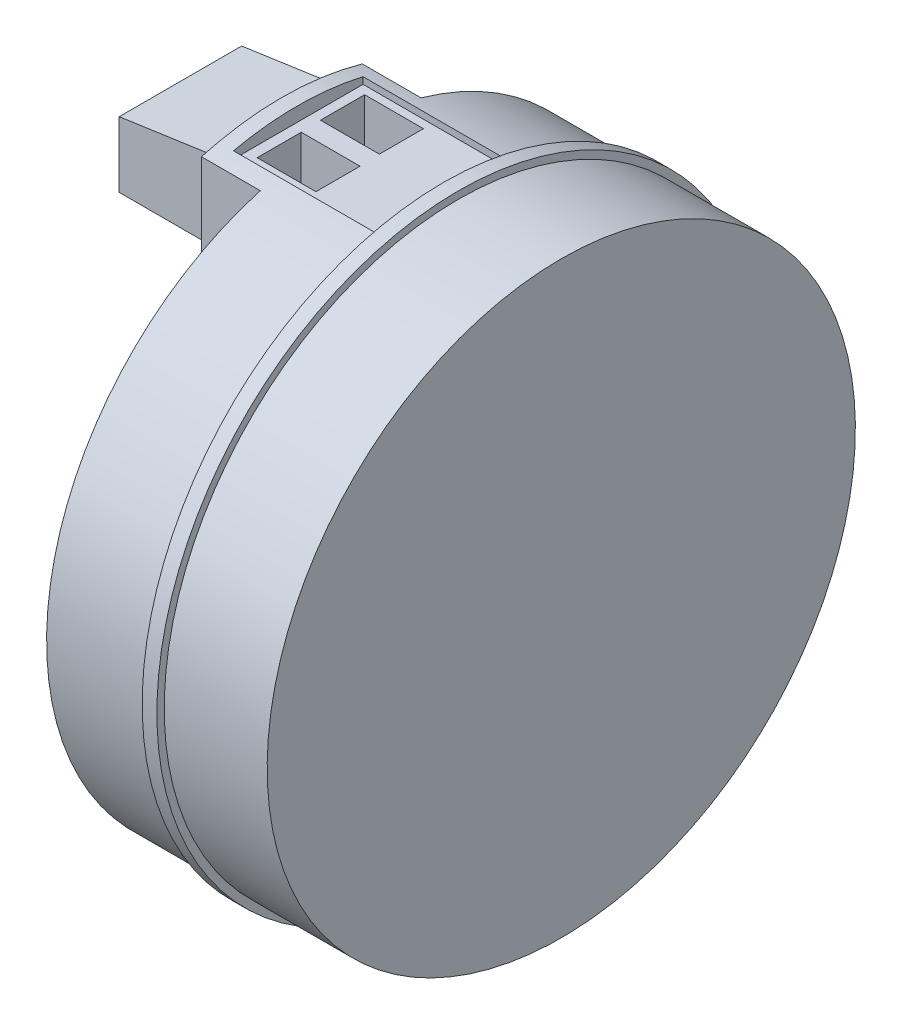
from build123d import *

# Parameters (mm, degrees)
SKETCH1_W           = 25.9
SKETCH1_H           = 20
CUT_EXTRUDE1_START  = -6.9
CUT_EXTRUDE1_DEPTH  = 6.9
CUT_EXTRUDE3_DEPTH  = 37.9
CUT_EXTRUDE4_START  = -4
CUT_EXTRUDE4_DEPTH  = 4
SKETCH5_W           = 3.079292118
SKETCH5_H           = 1.929571357
SKETCH5_H_2         = 4.46
SKETCH5_W_2         = 3.459055715
CUT_EXTRUDE5_DEPTH  = 6.9
CUT_EXTRUDE6_START  = -4
SKETCH6_W           = 1.774907729
SKETCH6_H           = 5.455649351
CUT_EXTRUDE6_DEPTH  = 4
SKETCH7_R           = 20.5
BOSS_EXTRUDE1_DEPTH = 0.5
SKETCH8_W           = 5.450728154
SKETCH8_H           = 14.349876159
CUT_EXTRUDE7_DEPTH  = 4
SKETCH9_W           = 5.450728154
SKETCH9_H           = 14.349876159
SKETCH9_W_2         = 4.355367047
SKETCH9_H_2         = 13.330062778
BOSS_EXTRUDE2_DEPTH = 3
SKETCH10_R          = 0.25
BOSS_EXTRUDE3_DEPTH = 3
FILLET1_R           = 0.1
FILLET2_R           = 0.1
FILLET3_R           = 0.1
FILLET4_R           = 0.1
SKETCH11_W          = 9.973758266
SKETCH11_H          = 8.809863574
CUT_EXTRUDE8_DEPTH  = 6.964735979
SKETCH12_W          = 9.973758266
SKETCH12_H          = 8.809863574
SKETCH12_W_2        = 4
SKETCH12_H_2        = 3
BOSS_EXTRUDE4_DEPTH = 6
SKETCH14_R          = 1
CUT_EXTRUDE9_DEPTH  = 12


with BuildPart() as part:
    # Sketch1 → Revolve1 (revolve)
    with BuildSketch(Plane.XY, mode=Mode.PRIVATE) as revolve1_sk:
        with Locations((40.726102109, -10)):
            Rectangle(SKETCH1_W, SKETCH1_H)
    revolve(revolve1_sk.sketch.rotate(Axis((71.094105119, 0, 0), (-1, 0, 0)), 180), axis=Axis((71.094105119, 0, 0), (-1, 0, 0)))

    # Sketch2 → Cut-Extrude1 (cut)
    with BuildSketch(Plane.ZY.offset(-27.776102109).offset(CUT_EXTRUDE1_START)):
        with BuildLine():
            ThreePointArc((7.621425239, 18.490913372), (0.204527107, 19.998954189), (-7.241661642, 18.642916528))
            Line((-7.241661642, 18.642916528), (7.621425239, 18.490913372))
        make_face()
        with BuildLine():
            Line((-7.241661642, 13.035264021), (-7.241661642, 18.642916528))
            ThreePointArc((-7.241661642, 18.642916528), (-11.295281474, -16.50504821), (20, 0))
            ThreePointArc((20, 0), (16.619694714, 11.12590435), (7.621425239, 18.490913372))
            Line((7.621425239, 18.490913372), (7.621425239, 13.035264021))
            Line((7.621425239, 13.035264021), (-7.241661642, 13.035264021))
        make_face()
    extrude(amount=CUT_EXTRUDE1_DEPTH, mode=Mode.SUBTRACT)

    # Sketch3 → Cut-Extrude3 (cut)
    with BuildSketch(Plane.XY.offset(7.621425239)):
        Polygon((27.776102109, 17.495264021), (34.676102109, 18.490913372), (27.776102109, 18.490913372), align=None)
        Polygon((27.776102109, 18.490913372), (34.676102109, 18.490913372), (34.676102109, 18.667614819), (27.776102109, 19.075412015), align=None)
    extrude(amount=-CUT_EXTRUDE3_DEPTH, mode=Mode.SUBTRACT)

    # Sketch4 → Cut-Extrude4 (cut)
    with BuildSketch(Plane.ZY.offset(-34.676102109).offset(CUT_EXTRUDE4_START)):
        with BuildLine():
            ThreePointArc((5.466753913, 5.13464718), (0, -7.5), (-5.466753913, 5.13464718))
            Line((-5.466753913, 5.13464718), (-5.466753913, 13.035264021))
            Line((-5.466753913, 13.035264021), (-7.241661642, 13.035264021))
            Line((-7.241661642, 13.035264021), (-7.241661642, 18.490913372))
            Line((-7.241661642, 18.490913372), (-5.466753913, 18.490913372))
            Line((-5.466753913, 18.490913372), (-5.466753913, 19.238362759))
            ThreePointArc((-5.466753913, 19.238362759), (-12.055391361, -15.958306274), (20, 0))
            ThreePointArc((20, 0), (16.619694714, 11.12590435), (7.621425239, 18.490913372))
            Line((7.621425239, 18.490913372), (7.621425239, 13.035264021))
            Line((7.621425239, 13.035264021), (5.466753913, 13.035264021))
            Line((5.466753913, 13.035264021), (5.466753913, 5.13464718))
        make_face()
    extrude(amount=CUT_EXTRUDE4_DEPTH, mode=Mode.SUBTRACT)

    # Sketch5 → Cut-Extrude5 (cut)
    with BuildSketch(Plane.ZY.offset(-27.776102109)):
        with Locations((-5.702015583, 18.4600497)):
            Rectangle(SKETCH5_W, SKETCH5_H)
        with Locations((-5.702015583, 15.265264021)):
            Rectangle(SKETCH5_W, SKETCH5_H_2)
        with Locations((5.891897381, 18.4600497)):
            Rectangle(SKETCH5_W_2, SKETCH5_H)
        with Locations((5.891897381, 15.265264021)):
            Rectangle(SKETCH5_W_2, SKETCH5_H_2)
    extrude(amount=-CUT_EXTRUDE5_DEPTH, mode=Mode.SUBTRACT)

    # Sketch6 → Cut-Extrude6 (cut)
    with BuildSketch(Plane.ZY.offset(-34.676102109).offset(CUT_EXTRUDE6_START)):
        with BuildLine():
            Line((5.466753913, 19.238362759), (5.466753913, 13.035264021))
            Line((5.466753913, 13.035264021), (7.621425239, 13.035264021))
            Line((7.621425239, 13.035264021), (7.621425239, 18.490913372))
            ThreePointArc((7.621425239, 18.490913372), (6.554752362, 18.895375664), (5.466753913, 19.238362759))
        make_face()
        with Locations((-6.354207778, 15.763088697)):
            Rectangle(SKETCH6_W, SKETCH6_H)
    extrude(amount=CUT_EXTRUDE6_DEPTH, mode=Mode.SUBTRACT)

    # Sketch7 → Boss-Extrude1 (add, symmetric)
    with BuildSketch(Plane.ZY.offset(-46.176102109)):
        with Locations(Location((0, 0, 0), (0, 0, 270))):
            Circle(SKETCH7_R)
    extrude(amount=BOSS_EXTRUDE1_DEPTH, both=True)

    # Sketch8 → Cut-Extrude7 (cut)
    with BuildSketch(Plane.ZY.offset(-38.676102109)):
        with Locations((-15.184171285, 0.083429512)):
            Rectangle(SKETCH8_W, SKETCH8_H)
    extrude(amount=-CUT_EXTRUDE7_DEPTH, mode=Mode.SUBTRACT)

    # Sketch9 → Boss-Extrude2 (add)
    with BuildSketch(Plane.ZY.offset(-42.676102109)):
        with Locations((-15.184171285, 0.083429512)):
            Rectangle(SKETCH9_W, SKETCH9_H)
        with Locations((-15.184204235, 0.116814581)):
            Rectangle(SKETCH9_W_2, SKETCH9_H_2, mode=Mode.SUBTRACT)
    extrude(amount=BOSS_EXTRUDE2_DEPTH)

    # Sketch10 → Boss-Extrude3 (add)
    with BuildSketch(Plane.ZY.offset(-42.676102109)):
        with Locations((-15.826659994, 4.106898055)):
            Circle(SKETCH10_R)
        with Locations((-15.826659994, 1.606898055)):
            Circle(SKETCH10_R)
        with Locations((-15.826659994, -3.393101945)):
            Circle(SKETCH10_R)
        with Locations((-15.826659994, -0.893101945)):
            Circle(SKETCH10_R)
    extrude(amount=BOSS_EXTRUDE3_DEPTH)

    # Fillet1
    fillet1_edges = [part.edges().sort_by_distance(p)[0] for p in [
        (39.676102109, 4.106898055, -16.076659994),
    ]]
    fillet(fillet1_edges, radius=FILLET1_R)

    # Fillet2
    fillet2_edges = [part.edges().sort_by_distance(p)[0] for p in [
        (39.676102109, 1.606898055, -16.076659994),
    ]]
    fillet(fillet2_edges, radius=FILLET2_R)

    # Fillet3
    fillet3_edges = [part.edges().sort_by_distance(p)[0] for p in [
        (39.676102109, -0.893101945, -16.076659994),
    ]]
    fillet(fillet3_edges, radius=FILLET3_R)

    # Fillet4
    fillet4_edges = [part.edges().sort_by_distance(p)[0] for p in [
        (39.676102109, -3.393101945, -16.076659994),
    ]]
    fillet(fillet4_edges, radius=FILLET4_R)

    # Sketch11 → Cut-Extrude8 (cut)
    with BuildSketch(Plane(origin=(0, 20, 0), x_dir=(1, 0, 0), z_dir=(0, 1, 0))):
        with Locations((40.689222976, 0.086069267)):
            Rectangle(SKETCH11_W, SKETCH11_H)
    extrude(amount=-CUT_EXTRUDE8_DEPTH, mode=Mode.SUBTRACT)

    # Sketch12 → Boss-Extrude4 (add)
    with BuildSketch(Plane(origin=(0, 13.035264021, 0), x_dir=(1, 0, 0), z_dir=(0, 1, 0))):
        with Locations((40.689222976, 0.086069267)):
            Rectangle(SKETCH12_W, SKETCH12_H)
        with Locations((38.421750687, -1.928820044)):
            Rectangle(SKETCH12_W_2, SKETCH12_H_2, mode=Mode.SUBTRACT)
        with Locations((38.366922829, 2.435416113)):
            Rectangle(SKETCH12_W_2, SKETCH12_H_2, mode=Mode.SUBTRACT)
    extrude(amount=BOSS_EXTRUDE4_DEPTH)

    # Sketch14 → Cut-Extrude9 (cut)
    with BuildSketch(Plane(origin=(36.421750687, 0, 0), x_dir=(0, 0, -1), z_dir=(1, 0, 0))):
        with Locations(Location((-1.928820044, 16.035264021, 0), (0, 0, 90))):
            Circle(SKETCH14_R)
        with Locations(Location((2.105292071, 16.035264021, 0), (0, 0, 90))):
            Circle(SKETCH14_R)
    extrude(amount=-CUT_EXTRUDE9_DEPTH, mode=Mode.SUBTRACT)


solid = part.part
